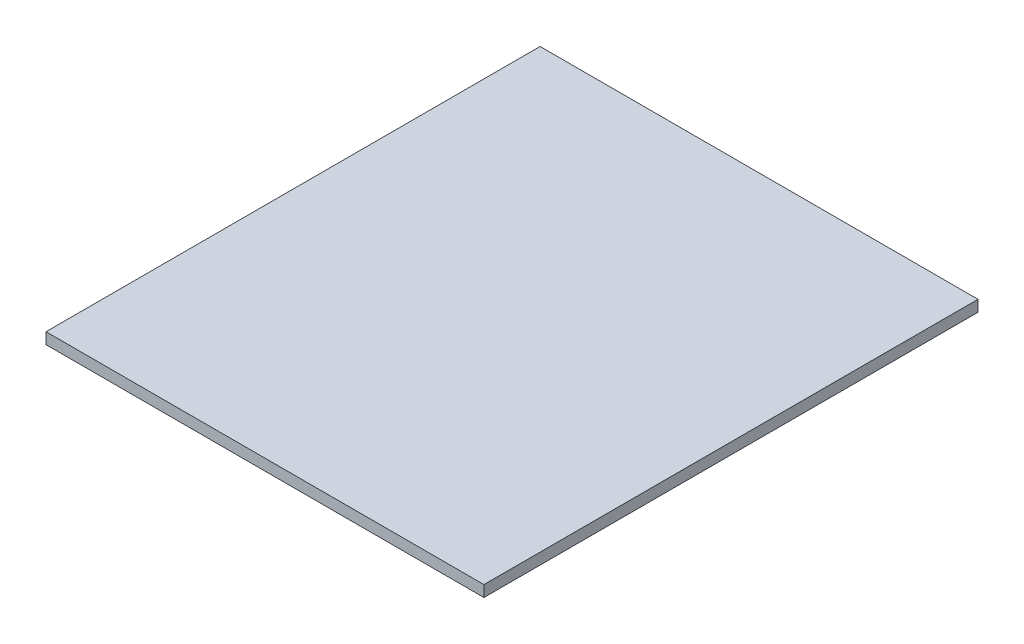
from build123d import *

# Parameters (mm, degrees)
SKETCH1_W           = 78
SKETCH1_H           = 88
BOSS_EXTRUDE1_DEPTH = 2


with BuildPart() as part:
    # Sketch1 → Boss-Extrude1 (new body)
    with BuildSketch(Plane(origin=(0, 0, 0), x_dir=(1, 0, 0), z_dir=(0, 1, 0))):
        with Locations((39, 44)):
            Rectangle(SKETCH1_W, SKETCH1_H)
    extrude(amount=BOSS_EXTRUDE1_DEPTH)


solid = part.part
